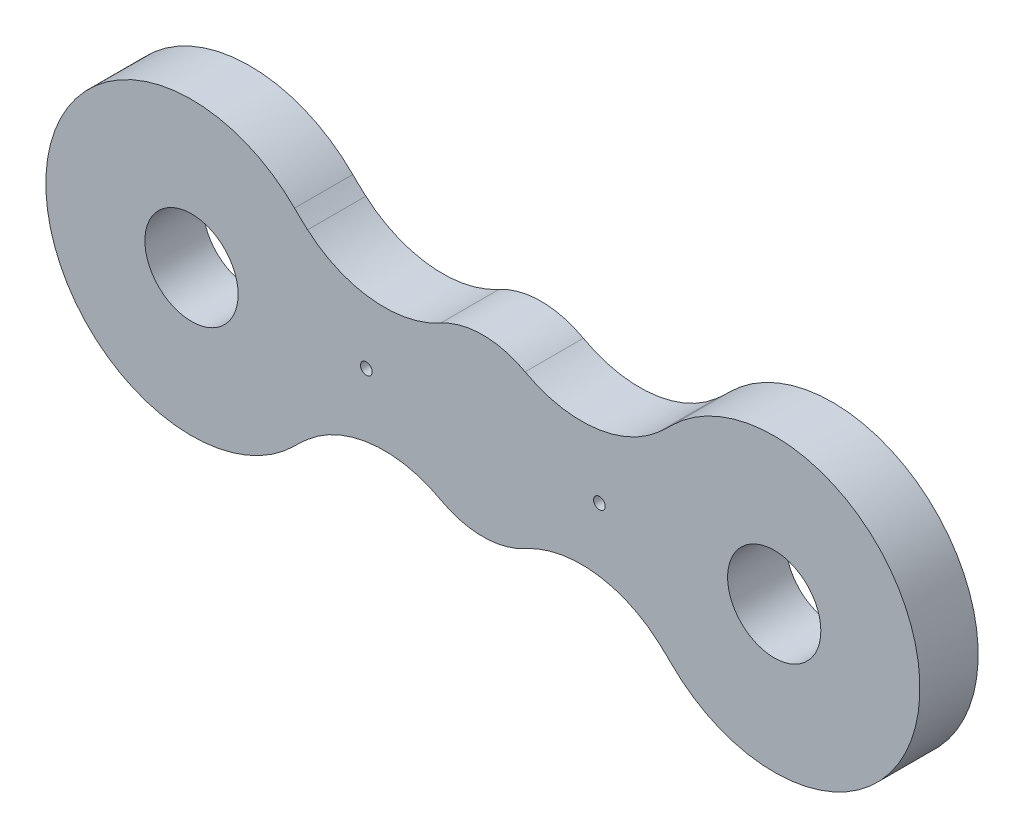
from build123d import *

# Parameters (mm, degrees)
SKETCH_1_R      = 4
SKETCH_1_R_2    = 0.5
EXTRUDE_1_DEPTH = 5


with BuildPart() as part:
    # 草圖1 → 填料-伸長1 (new body)
    with BuildSketch(Plane.XY):
        with BuildLine():
            ThreePointArc((-16.161165235, 8.838834765), (-37.5, 0), (-16.161165235, -8.838834765))
            ThreePointArc((-16.161165235, -8.838834765), (-15.608913833, -8.304841047), (-15.039028639, -7.789708279))
            ThreePointArc((-15.039028639, -7.789708279), (-9.525276207, -5.376821949), (-3.625257572, -6.56563078))
            ThreePointArc((-3.625257572, -6.56563078), (0, -7.5), (3.625257572, -6.56563078))
            ThreePointArc((3.625257572, -6.56563078), (9.525276207, -5.376821949), (15.039028639, -7.789708279))
            ThreePointArc((15.039028639, -7.789708279), (15.608913833, -8.304841047), (16.161165235, -8.838834765))
            ThreePointArc((16.161165235, -8.838834765), (37.5, 0), (16.161165235, 8.838834765))
            ThreePointArc((16.161165235, 8.838834765), (15.608913833, 8.304841047), (15.039028639, 7.789708279))
            ThreePointArc((15.039028639, 7.789708279), (9.525276207, 5.376821949), (3.625257572, 6.56563078))
            ThreePointArc((3.625257572, 6.56563078), (0, 7.5), (-3.625257572, 6.56563078))
            ThreePointArc((-3.625257572, 6.56563078), (-9.525276207, 5.376821949), (-15.039028639, 7.789708279))
            ThreePointArc((-15.039028639, 7.789708279), (-15.608913833, 8.304841047), (-16.161165235, 8.838834765))
        make_face()
        with Locations((-25, 0)):
            Circle(SKETCH_1_R, mode=Mode.SUBTRACT)
        with Locations((25, 0)):
            Circle(SKETCH_1_R, mode=Mode.SUBTRACT)
        with Locations((-10, 0)):
            Circle(SKETCH_1_R_2, mode=Mode.SUBTRACT)
        with Locations((10, 0)):
            Circle(SKETCH_1_R_2, mode=Mode.SUBTRACT)
    extrude(amount=EXTRUDE_1_DEPTH)


solid = part.part
